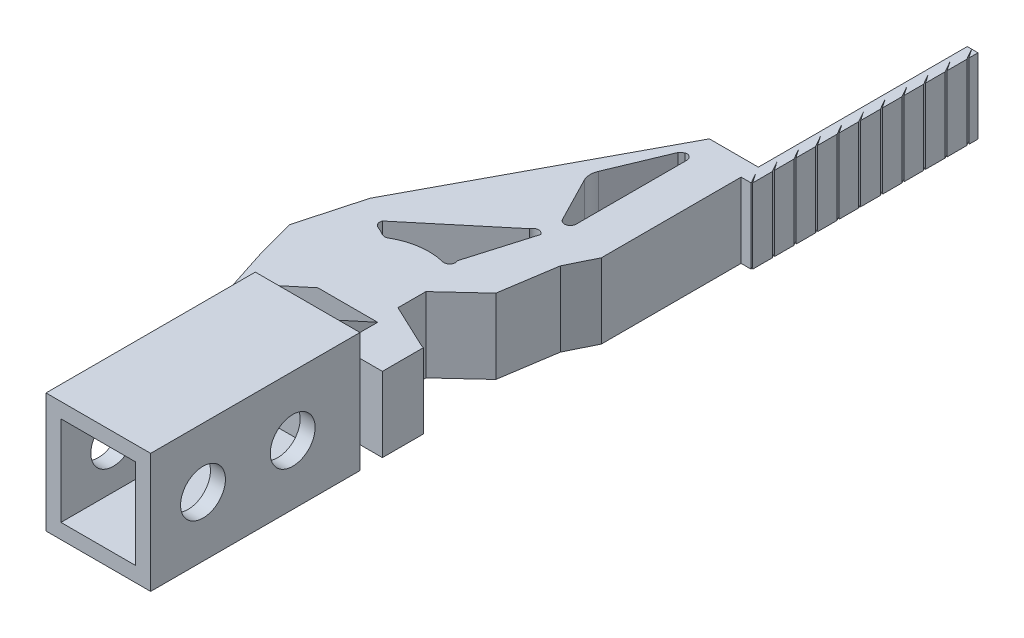
from build123d import *

# Parameters (mm, degrees)
SALIENTE_EXTRUIR1_DEPTH = 5
SALIENTE_EXTRUIR2_DEPTH = 10
CUT_EXTRUDE1_DEPTH      = 95.93998922245981
BOSS_EXTRUDE2_DEPTH     = 28
SKETCH9_W               = 10.000000000000002
SKETCH9_H               = 12
CUT_EXTRUDE5_DEPTH      = 25.5
BOSS_EXTRUDE4_DEPTH     = 4
SKETCH8_R               = 2.999999999999989
CUT_EXTRUDE6_DEPTH      = 30


with BuildPart() as part:
    # Croquis1 → Saliente-Extruir1 (new, symmetric)
    with BuildSketch(Plane(origin=(0, 0, 0), x_dir=(1, 0, 0), z_dir=(0, 1, 0))):
        Polygon((26.915963098267575, -65.33925873527804), (28.72327045931731, -61.65948350871261), (28.72327045931731, -40.659483508712604), (22.170681671405973, -40.659483508712604), (6.35406798016902, -70.23576145650345), (4.0317775841889825, -78.69685690697727), (5.433122947121303, -83.88896685505465), (7.2356662280183635, -89.46256866352141), (27.235666228018367, -89.46256866352135), (27.235666228018367, -83.99084385179745), (26.915963098267575, -83.88896685505465), (20.90447714075739, -81.05101682856319), (20.90447714075739, -77.31259376727242), (25.764663289477145, -72.8187400941099), align=None)
        with BuildLine():
            Line((9.821066256588082, -72.04316428414087), (20.5589333036859, -63.08706400458823))
            ThreePointArc((20.5589333036859, -63.08706400458823), (20.767764666496063, -62.79849907988661), (21.083118079778938, -62.6328715501941))
            ThreePointArc((21.083118079778938, -62.6328715501941), (21.597621770602938, -62.67624114259194), (21.972309386725804, -63.031493390636115))
            Line((21.9723093867258, -63.031493390636115), (19.44429254500012, -71.61767013188037))
            ThreePointArc((19.44429254500012, -71.61767013188037), (19.502654350523237, -72.1808265025535), (19.16473943472284, -72.63510032730379))
            ThreePointArc((19.16473943472284, -72.63510032730379), (18.905879524091997, -72.73854256608807), (18.62717721828115, -72.74435417793264))
            ThreePointArc((18.62717721828115, -72.74435417793264), (18.593500542050098, -72.73819972124883), (18.560126358304874, -72.73057346932643))
            ThreePointArc((18.560126358304874, -72.73057346932643), (15.281159258646955, -72.55317807186373), (12.175699872191544, -73.62051886409272))
            ThreePointArc((12.175699872191544, -73.62051886409272), (11.987578727371515, -73.69844119364632), (11.785699872191557, -73.72501904914084))
            ThreePointArc((11.785699872191557, -73.72501904914084), (11.583821017011589, -73.69844119364633), (11.395699872191557, -73.62051886409272))
            ThreePointArc((11.395699872191557, -73.62051886409272), (10.835248951640853, -73.32399517310118), (10.254430336713742, -73.06967004610912))
            ThreePointArc((10.254430336713742, -73.06967004610912), (10.011115132081741, -72.9167732340473), (9.839678957283844, -72.68614504428194))
            ThreePointArc((9.839678957283844, -72.68614504428194), (9.76100515957486, -72.36666268002743), (9.821066256588082, -72.04316428414087))
        make_face(mode=Mode.SUBTRACT)
        with BuildLine():
            Line((21.672345420619333, -59.808429563113535), (18.5917806510747, -53.81351265341419))
            ThreePointArc((18.5917806510747, -53.81351265341419), (18.51589589891999, -53.65076212808047), (18.452714922493957, -53.48267169609864))
            ThreePointArc((18.452714922493957, -53.48267169609864), (18.334713754625824, -52.65637444161208), (18.514235075155533, -51.84122812108702))
            Line((18.514235075155533, -51.84122812108702), (21.64649689531295, -44.35103681201493))
            Line((21.64649689531295, -44.35103681201493), (22.170681671405973, -43.89684435762081))
            ThreePointArc((22.170681671405973, -43.89684435762081), (22.519573206251422, -43.88721151653816), (22.837737106462836, -44.03070307488359))
            ThreePointArc((22.837737106462836, -44.03070307488359), (23.06477570342122, -44.30517298097964), (23.146109199486098, -44.65196559376006))
            Line((23.146109199486098, -44.65196559376006), (23.146109199486098, -59.45193016741627))
            ThreePointArc((23.146109199486098, -59.45193016741627), (23.06477570342123, -59.7987227801967), (22.837737106462843, -60.07319268629275))
            ThreePointArc((22.837737106462843, -60.07319268629275), (22.19330594649592, -60.21254770320941), (21.672345420619333, -59.808429563113535))
        make_face(mode=Mode.SUBTRACT)
    extrude(amount=SALIENTE_EXTRUIR1_DEPTH, both=True)

    # Croquis2 → Saliente-Extruir2 (add)
    with BuildSketch(Plane.XZ.offset(5)):
        Polygon((30.16704098325694, 42.969154574791474), (28.723270459317312, 42.969154574791474), (28.723270459317316, 12.721213466502482), (30.16704098325694, 12.721213466502482), align=None)
    extrude(amount=-SALIENTE_EXTRUIR2_DEPTH)

    # Sketch2 → Cut-Extrude1 (cut, through all)
    with BuildSketch(Plane(origin=(0, 5, 0), x_dir=(1, 0, 0), z_dir=(0, 1, 0))):
        Polygon((30.16704098325694, -13.957420664168177), (29.31745769455622, -12.721213466502482), (30.16704098325694, -14.22121346650248), align=None)
        Polygon((30.16704098325694, -16.848244602946536), (30.16704098325694, -17.11203740528084), (29.31745769455622, -15.61203740528084), align=None)
        Polygon((29.31745769455622, -18.502861344059202), (30.16704098325694, -20.002861344059202), (30.16704098325694, -19.739068541724897), align=None)
        Polygon((29.31745769455622, -21.393685282837563), (30.16704098325694, -22.893685282837563), (30.16704098325694, -22.62989248050326), align=None)
        Polygon((29.31745769455622, -24.284509221615924), (30.16704098325694, -25.78450922161592), (30.16704098325694, -25.520716419281616), align=None)
        Polygon((29.31745769455622, -27.17533316039428), (30.16704098325694, -28.675333160394278), (30.16704098325694, -28.411540358059977), align=None)
        Polygon((29.31745769455622, -30.066157099172642), (30.16704098325694, -31.56615709917264), (30.16704098325694, -31.302364296838338), align=None)
        Polygon((29.31745769455622, -32.956981037951), (30.16704098325694, -34.456981037951), (30.16704098325694, -34.193188235616695), align=None)
        Polygon((29.31745769455622, -35.847804976729364), (30.16704098325694, -37.347804976729364), (30.16704098325694, -37.084012174395056), align=None)
        Polygon((29.31745769455622, -38.738628915507725), (30.16704098325694, -40.238628915507725), (30.16704098325694, -39.97483611317342), align=None)
        Polygon((29.31745769455622, -41.629452854286086), (30.16704098325694, -43.12945285428608), (30.16704098325694, -42.86566005195178), align=None)
        Polygon((29.31745769455622, -44.52027679306445), (30.16704098325694, -46.02027679306444), (30.16704098325694, -45.75648399073014), align=None)
        Polygon((29.31745769455622, -47.41110073184281), (30.16704098325694, -48.9111007318428), (30.16704098325694, -48.6473079295085), align=None)
        Polygon((29.31745769455622, -50.30192467062117), (30.16704098325694, -51.80192467062116), (30.16704098325694, -51.53813186828686), align=None)
        Polygon((29.31745769455622, -53.192748609399516), (30.16704098325694, -54.692748609399516), (30.16704098325694, -54.428955807065215), align=None)
    extrude(amount=-CUT_EXTRUDE1_DEPTH, mode=Mode.SUBTRACT)


with BuildPart() as cut_extrude1_piece_1:
    # of the separate pieces the step leaves, piece 1, a body of its own (cut_extrude1_pieces)
    add(part.part.solids().sort_by_distance((26.915963098, -5, 65.339258735))[0])

    # Sketch7 → Boss-Extrude2 (add)
    with BuildSketch(Plane.XY.offset(89.46256866352142)):
        Polygon((10.235666228018118, 7.9999999999999964), (10.23566622801812, -8.000000000000004), (24.23566622801812, -8.000000000000004), (24.23566622801812, 7.9999999999999964), align=None)
    extrude(amount=BOSS_EXTRUDE2_DEPTH)

    # Sketch9 → Cut-Extrude5 (cut)
    with BuildSketch(Plane.XY.offset(117.46256866352142)):
        with Locations((17.23566622801837, 0)):
            Rectangle(SKETCH9_W, SKETCH9_H)
    extrude(amount=-CUT_EXTRUDE5_DEPTH, mode=Mode.SUBTRACT)

    # Sketch10 → Boss-Extrude4 (add, symmetric)
    with BuildSketch(Plane(origin=(17.235666228018367, 0, 0), x_dir=(0, 0, -1), z_dir=(1, 3.5e-16, 0))):
        Polygon((-84.0979108440365, 5.000000000000003), (-89.46256866352141, 5.0000000000000036), (-89.46256866352141, 7.925681422350478), align=None)
        Polygon((-89.46256866352141, -5.0000000000000036), (-84.0979108440365, -5.000000000000003), (-89.46256866352141, -7.925681422350478), align=None)
    extrude(amount=BOSS_EXTRUDE4_DEPTH, both=True)

    # Sketch8 → Cut-Extrude6 (cut)
    with BuildSketch(Plane.ZY.offset(-10.235666228018367)):
        with Locations(Location((98.46256866352141, -3.045e-14, 0), (0, 0, 270))):
            Circle(SKETCH8_R)
        with Locations(Location((110.46256866352141, -2.605e-14, 0), (0, 0, 270))):
            Circle(SKETCH8_R)
    extrude(amount=-CUT_EXTRUDE6_DEPTH, mode=Mode.SUBTRACT)


with BuildPart() as cut_extrude1_piece_2:
    # of the separate pieces the step leaves, piece 2, a body of its own (cut_extrude1_pieces)
    add(part.part.solids().sort_by_distance((30.167040983, -5, 12.721213467))[0])


solid = Compound([cut_extrude1_piece_1.part, cut_extrude1_piece_2.part])
